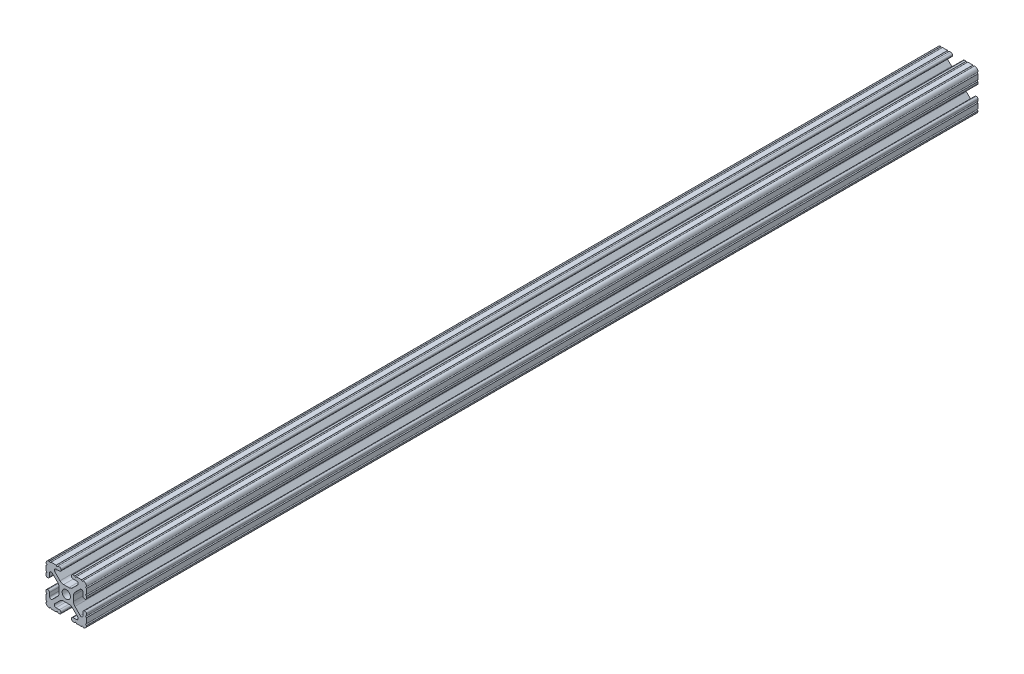
from build123d import *

# Parameters (mm, degrees)
SKETCH1_R           = 2.6035
BOSS_EXTRUDE1_DEPTH = 279.4


with BuildPart() as part:
    # Sketch1 → Boss-Extrude1 (new, symmetric)
    with BuildSketch(Plane.XY):
        with BuildLine():
            Line((-7.179650497, -8.645192506), (-3.952270251, -5.423690499))
            ThreePointArc((-3.952270251, -5.423690499), (-2.922936451, -4.736929036), (-1.709253557, -4.4958))
            Line((-1.709253557, -4.4958), (1.709253557, -4.4958))
            ThreePointArc((1.709253557, -4.4958), (2.922936451, -4.736929036), (3.952270251, -5.423690499))
            Line((3.952270251, -5.423690499), (7.179650497, -8.645192506))
            ThreePointArc((7.179650497, -8.645192506), (7.41473083, -9.822813117), (6.416408329, -10.4902))
            Line((6.416408329, -10.4902), (4.287512407, -10.4902))
            ThreePointArc((4.287512407, -10.4902), (3.54574862, -10.79744862), (3.2385, -11.539212407))
            Line((3.2385, -11.539212407), (3.2385, -11.650987593))
            ThreePointArc((3.2385, -11.650987593), (3.54574862, -12.39275138), (4.287512407, -12.7))
            Line((4.287512407, -12.7), (5.317126718, -12.7))
            ThreePointArc((5.317126718, -12.7), (5.825126718, -12.192), (6.333126718, -12.7))
            Line((6.333126718, -12.7), (9.550443118, -12.7))
            ThreePointArc((9.550443118, -12.7), (10.058366869, -12.192000006), (10.566443095, -12.699847501))
            ThreePointArc((10.566443095, -12.699847501), (12.082537762, -12.08250727), (12.699846982, -10.566399977))
            ThreePointArc((12.699846982, -10.566399977), (12.192000006, -10.058323491), (12.7, -9.5504))
            Line((12.7, -9.5504), (12.7, -6.3330836))
            ThreePointArc((12.7, -6.3330836), (12.192, -5.8250836), (12.7, -5.3170836))
            Line((12.7, -5.3170836), (12.7, -4.287469289))
            ThreePointArc((12.7, -4.287469289), (12.39275138, -3.545705502), (11.650987593, -3.238456882))
            Line((11.650987593, -3.238456882), (11.539212407, -3.238456882))
            ThreePointArc((11.539212407, -3.238456882), (10.79744862, -3.545705502), (10.4902, -4.287469289))
            Line((10.4902, -4.287469289), (10.4902, -6.402089023))
            ThreePointArc((10.4902, -6.402089023), (9.856505071, -7.351067942), (8.737131347, -7.129408934))
            Line((8.737131347, -7.129408934), (5.441005833, -3.840816462))
            ThreePointArc((5.441005833, -3.840816462), (4.750877967, -2.809883091), (4.5085, -1.593185507))
            Line((4.5085, -1.593185507), (4.5085, 1.593185507))
            ThreePointArc((4.5085, 1.593185507), (4.750877967, 2.809883091), (5.441005833, 3.840816462))
            Line((5.441005833, 3.840816462), (8.737131347, 7.129408934))
            ThreePointArc((8.737131347, 7.129408934), (9.856505071, 7.351067942), (10.4902, 6.402089023))
            Line((10.4902, 6.402089023), (10.4902, 4.287469289))
            ThreePointArc((10.4902, 4.287469289), (10.79744862, 3.545705502), (11.539212407, 3.238456882))
            Line((11.539212407, 3.238456882), (11.650987593, 3.238456882))
            ThreePointArc((11.650987593, 3.238456882), (12.39275138, 3.545705502), (12.7, 4.287469289))
            Line((12.7, 4.287469289), (12.7, 5.3170836))
            ThreePointArc((12.7, 5.3170836), (12.192, 5.8250836), (12.7, 6.3330836))
            Line((12.7, 6.3330836), (12.7, 9.5504))
            ThreePointArc((12.7, 9.5504), (12.192000006, 10.058323491), (12.699846982, 10.566399977))
            ThreePointArc((12.699846982, 10.566399977), (12.082537762, 12.08250727), (10.566443095, 12.699847501))
            ThreePointArc((10.566443095, 12.699847501), (10.058366869, 12.192000006), (9.550443118, 12.7))
            Line((9.550443118, 12.7), (6.333126718, 12.7))
            ThreePointArc((6.333126718, 12.7), (5.825126718, 12.192), (5.317126718, 12.7))
            Line((5.317126718, 12.7), (4.287512407, 12.7))
            ThreePointArc((4.287512407, 12.7), (3.54574862, 12.39275138), (3.2385, 11.650987593))
            Line((3.2385, 11.650987593), (3.2385, 11.539212407))
            ThreePointArc((3.2385, 11.539212407), (3.54574862, 10.79744862), (4.287512407, 10.4902))
            Line((4.287512407, 10.4902), (6.476788598, 10.4902))
            ThreePointArc((6.476788598, 10.4902), (7.432222385, 9.85140422), (7.207036008, 8.724370562))
            Line((7.207036008, 8.724370562), (3.898272566, 5.423169045))
            ThreePointArc((3.898272566, 5.423169045), (2.869120213, 4.736787962), (1.655778399, 4.4958))
            Line((1.655778399, 4.4958), (-1.655778399, 4.4958))
            ThreePointArc((-1.655778399, 4.4958), (-2.869120213, 4.736787962), (-3.898272566, 5.423169045))
            Line((-3.898272566, 5.423169045), (-7.207036008, 8.724370562))
            ThreePointArc((-7.207036008, 8.724370562), (-7.432222385, 9.85140422), (-6.476788598, 10.4902))
            Line((-6.476788598, 10.4902), (-4.287512407, 10.4902))
            ThreePointArc((-4.287512407, 10.4902), (-3.54574862, 10.79744862), (-3.2385, 11.539212407))
            Line((-3.2385, 11.539212407), (-3.2385, 11.650987593))
            ThreePointArc((-3.2385, 11.650987593), (-3.54574862, 12.39275138), (-4.287512407, 12.7))
            Line((-4.287512407, 12.7), (-5.317126718, 12.7))
            ThreePointArc((-5.317126718, 12.7), (-5.825126718, 12.192), (-6.333126718, 12.7))
            Line((-6.333126718, 12.7), (-9.550443118, 12.7))
            ThreePointArc((-9.550443118, 12.7), (-10.058366869, 12.192000006), (-10.566443095, 12.699847501))
            ThreePointArc((-10.566443095, 12.699847501), (-12.082537762, 12.08250727), (-12.699846982, 10.566399977))
            ThreePointArc((-12.699846982, 10.566399977), (-12.192000006, 10.058323491), (-12.7, 9.5504))
            Line((-12.7, 9.5504), (-12.7, 6.3330836))
            ThreePointArc((-12.7, 6.3330836), (-12.192, 5.8250836), (-12.7, 5.3170836))
            Line((-12.7, 5.3170836), (-12.7, 4.287469289))
            ThreePointArc((-12.7, 4.287469289), (-12.39275138, 3.545705502), (-11.650987593, 3.238456882))
            Line((-11.650987593, 3.238456882), (-11.539212407, 3.238456882))
            ThreePointArc((-11.539212407, 3.238456882), (-10.79744862, 3.545705502), (-10.4902, 4.287469289))
            Line((-10.4902, 4.287469289), (-10.4902, 6.402089023))
            ThreePointArc((-10.4902, 6.402089023), (-9.856505071, 7.351067942), (-8.737131347, 7.129408934))
            Line((-8.737131347, 7.129408934), (-5.441005833, 3.840816462))
            ThreePointArc((-5.441005833, 3.840816462), (-4.750877967, 2.809883091), (-4.5085, 1.593185507))
            Line((-4.5085, 1.593185507), (-4.5085, -1.593185507))
            ThreePointArc((-4.5085, -1.593185507), (-4.750877967, -2.809883091), (-5.441005833, -3.840816462))
            Line((-5.441005833, -3.840816462), (-8.737131347, -7.129408934))
            ThreePointArc((-8.737131347, -7.129408934), (-9.856505071, -7.351067942), (-10.4902, -6.402089023))
            Line((-10.4902, -6.402089023), (-10.4902, -4.287469289))
            ThreePointArc((-10.4902, -4.287469289), (-10.79744862, -3.545705502), (-11.539212407, -3.238456882))
            Line((-11.539212407, -3.238456882), (-11.650987593, -3.238456882))
            ThreePointArc((-11.650987593, -3.238456882), (-12.39275138, -3.545705502), (-12.7, -4.287469289))
            Line((-12.7, -4.287469289), (-12.7, -5.3170836))
            ThreePointArc((-12.7, -5.3170836), (-12.192, -5.8250836), (-12.7, -6.3330836))
            Line((-12.7, -6.3330836), (-12.7, -9.5504))
            ThreePointArc((-12.7, -9.5504), (-12.192000006, -10.058323491), (-12.699846982, -10.566399977))
            ThreePointArc((-12.699846982, -10.566399977), (-12.082537762, -12.08250727), (-10.566443095, -12.699847501))
            ThreePointArc((-10.566443095, -12.699847501), (-10.058366869, -12.192000006), (-9.550443118, -12.7))
            Line((-9.550443118, -12.7), (-6.333126718, -12.7))
            ThreePointArc((-6.333126718, -12.7), (-5.825126718, -12.192), (-5.317126718, -12.7))
            Line((-5.317126718, -12.7), (-4.287512407, -12.7))
            ThreePointArc((-4.287512407, -12.7), (-3.54574862, -12.39275138), (-3.2385, -11.650987593))
            Line((-3.2385, -11.650987593), (-3.2385, -11.539212407))
            ThreePointArc((-3.2385, -11.539212407), (-3.54574862, -10.79744862), (-4.287512407, -10.4902))
            Line((-4.287512407, -10.4902), (-6.416408329, -10.4902))
            ThreePointArc((-6.416408329, -10.4902), (-7.41473083, -9.822813117), (-7.179650497, -8.645192506))
        make_face()
        Circle(SKETCH1_R, mode=Mode.SUBTRACT)
    extrude(amount=BOSS_EXTRUDE1_DEPTH, both=True)


solid = part.part
